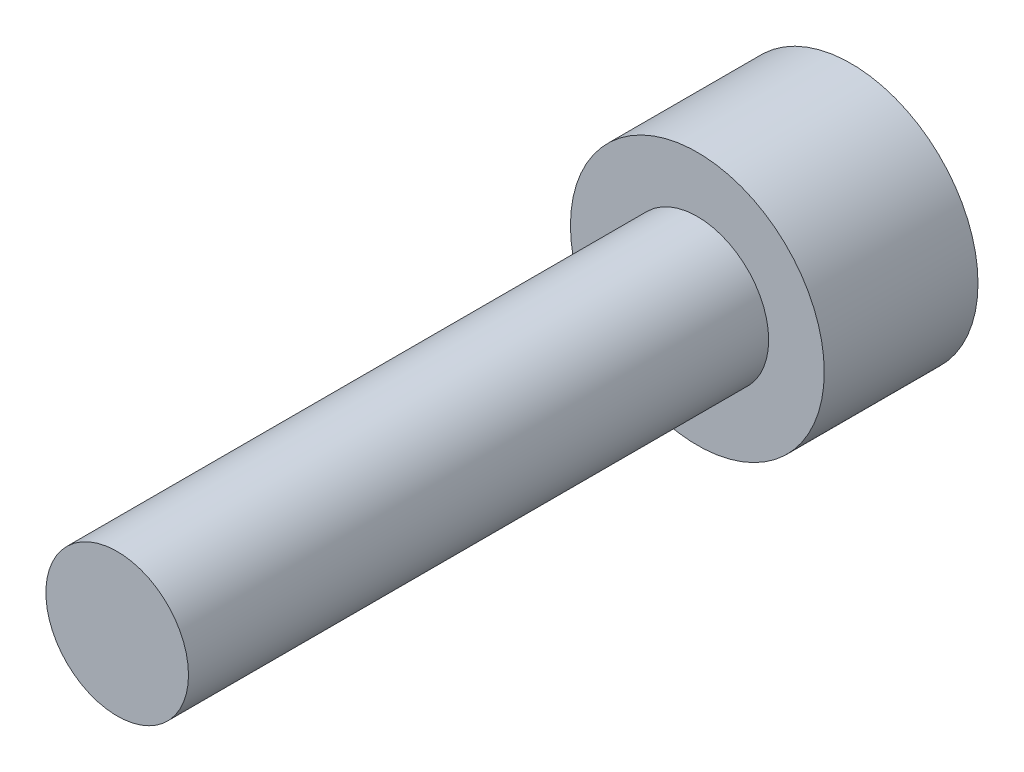
from build123d import *

# Parameters (mm, degrees)
SKETCH1_R           = 2.625
BOSS_EXTRUDE1_DEPTH = 3.18
SKETCH2_R           = 1.475
BOSS_EXTRUDE2_DEPTH = 12


with BuildPart() as part:
    # Sketch1 → Boss-Extrude1 (new body)
    with BuildSketch(Plane.XY):
        with Locations(Location((0, 0, 0), (0, 0, 180))):
            Circle(SKETCH1_R)
    extrude(amount=BOSS_EXTRUDE1_DEPTH)

    # Sketch2 → Boss-Extrude2 (add)
    with BuildSketch(Plane.XY.offset(3.18)):
        Circle(SKETCH2_R)
    extrude(amount=BOSS_EXTRUDE2_DEPTH)


solid = part.part
